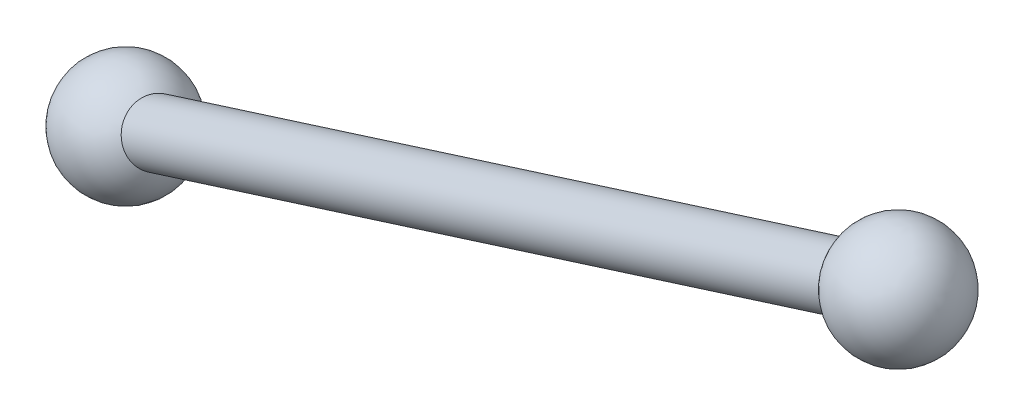
from build123d import *

# Parameters (mm, degrees)
THREE_MILLIMETRE_STRUT_CORE_SKETCH_R = 1.5
THREE_MILLIMETRE_STRUT_CORE_DEPTH    = 64.364941753


with BuildPart() as part:
    # Three millimetre strut core sketch → Three millimetre strut core (new body)
    with BuildSketch(Plane(origin=(-47.508082523, -23.76220438, -12.729752346), x_dir=(-0.20842845999452628, -0.10425004340144392, 0.9724656834640013), z_dir=(-0.8697399638531149, -0.435019425763827, -0.23304612093938143))):
        with Locations(Location((13.090181548, -53.527480937, 0), (0, 0, 270))):
            Circle(THREE_MILLIMETRE_STRUT_CORE_SKETCH_R)
    extrude(amount=THREE_MILLIMETRE_STRUT_CORE_DEPTH)

    # Ball end 1 profile → Ball end 1 (revolve)
    with BuildSketch(Plane(origin=(0, -73, 0), x_dir=(-1, 0, 0), z_dir=(0, -1, 0))):
        with BuildLine():
            Line((26.291651246, -3), (26.291651246, 3))
            ThreePointArc((26.291651246, 3), (23.291651246, 0), (26.291651246, -3))
        make_face()
    revolve(axis=Axis((-26.291651246, -73, -10), (0, 0, 1)))

    # Ball end 2 profile → Ball end 2 (revolve)
    with BuildSketch(Plane(origin=(0, -101.000000001, 0), x_dir=(-1, 0, 0), z_dir=(0, -1, 0))):
        with BuildLine():
            Line((82.272413359, 12), (82.272413359, 18))
            ThreePointArc((82.272413359, 18), (79.272413359, 15), (82.272413359, 12))
        make_face()
    revolve(axis=Axis((-82.272413359, -101.000000001, -25), (0, 0, 1)))


solid = part.part
